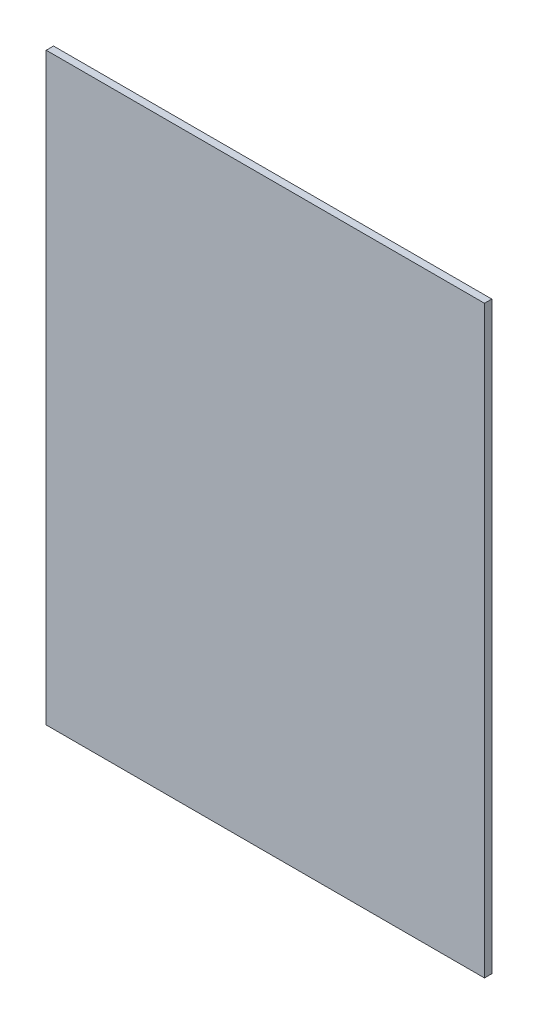
from build123d import *

# Parameters (mm, degrees)
SKETCH1_W           = 152.4
SKETCH1_H           = 203.2
BOSS_EXTRUDE1_DEPTH = 2.54


with BuildPart() as part:
    # Sketch1 → Boss-Extrude1 (new body)
    with BuildSketch(Plane.XY):
        with Locations((76.2, 101.6)):
            Rectangle(SKETCH1_W, SKETCH1_H)
    extrude(amount=BOSS_EXTRUDE1_DEPTH)


solid = part.part
